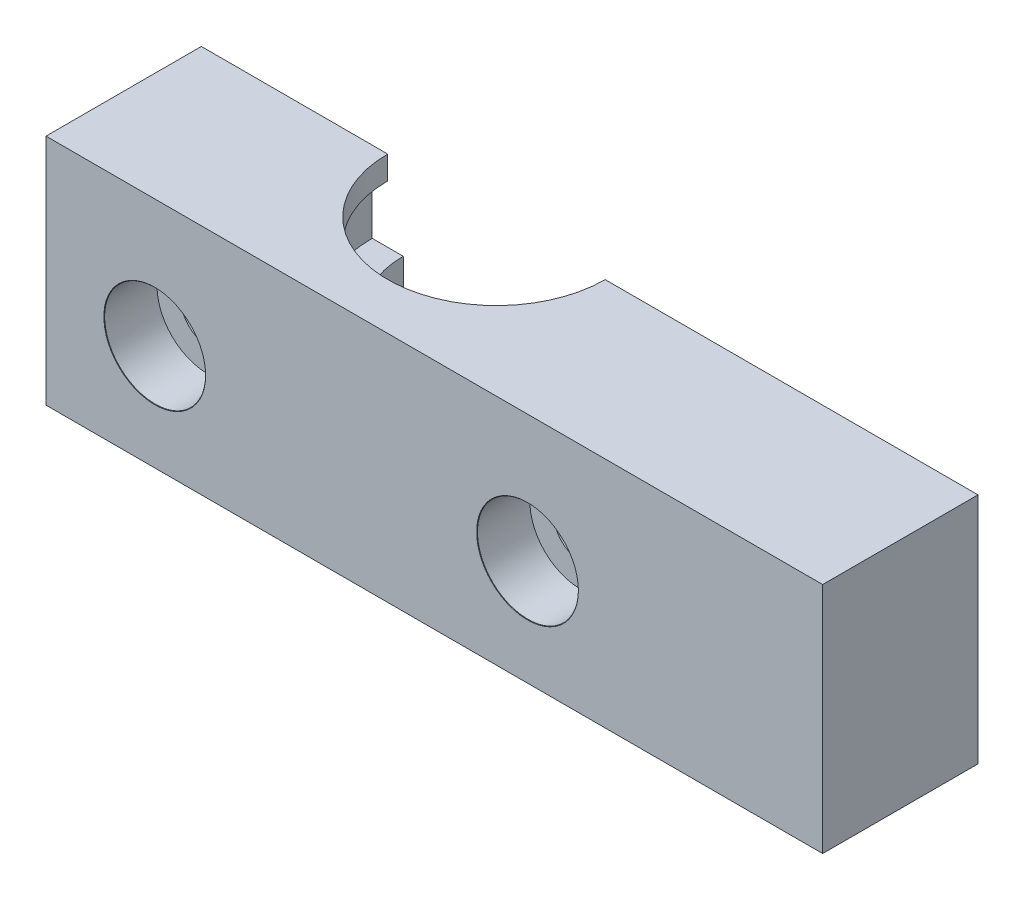
from build123d import *

# Parameters (mm, degrees)
SKETCH1_W                                    = 50
SKETCH1_H                                    = 15
BOSS_EXTRUDE1_DEPTH                          = 10
CBORE_FOR_M3_HEX_SOCKET_HEAD_CAP_SCR_2_COUNT = 2
CBORE_FOR_M3_HEX_SOCKET_HEAD_CAP_SCR_2_PITCH = 24


with BuildPart() as part:
    # Sketch1 → Boss-Extrude1 (new body)
    with BuildSketch(Plane.XY):
        with Locations((6, 9.5)):
            Rectangle(SKETCH1_W, SKETCH1_H)
    extrude(amount=BOSS_EXTRUDE1_DEPTH)

    # Sketch2 → Cut-Revolve1 (revolve, cut)
    with BuildSketch(Plane(origin=(0, 0, 0), x_dir=(0, 0, -1), z_dir=(1, 0, 0))):
        Polygon((0, 17), (-7, 17), (-7, 15.5), (-8, 15.5), (-8, 11.8), (-6, 11.8), (-6, 5.8), (-8, 5.8), (-8, 2.8), (-6.25, 2.8), (-6.25, 2), (0, 2), align=None)
    revolve(axis=Axis((0, 2, 0), (0, 1, 0)), mode=Mode.SUBTRACT)

    # Sketch4 → CBORE for M3 Hex Socket Head Cap Screw1 (revolve, cut)
    with BuildSketch(Plane(origin=(-12, 8.8, 10), x_dir=(0, -1, 0), z_dir=(1, 0, 0))):
        Polygon((0, 0), (0, 10), (1.7, 10), (1.7, 3.4), (3.25, 3.4), (3.25, 0.025), (3.275, 0), align=None)
    cbore_for_m3_hex_socket_head_cap_screw1 = revolve(axis=Axis((-12, 8.8, 16.35), (0, 0, -1)), mode=Mode.SUBTRACT)

    # CBORE for M3 Hex Socket Head Cap Scr 2: CBORE for M3 Hex Socket Head Cap Screw1 ×2
    with Locations(*[(i * CBORE_FOR_M3_HEX_SOCKET_HEAD_CAP_SCR_2_PITCH, 0, 0) for i in range(1, CBORE_FOR_M3_HEX_SOCKET_HEAD_CAP_SCR_2_COUNT)]):
        add(cbore_for_m3_hex_socket_head_cap_screw1, mode=Mode.SUBTRACT)


solid = part.part
